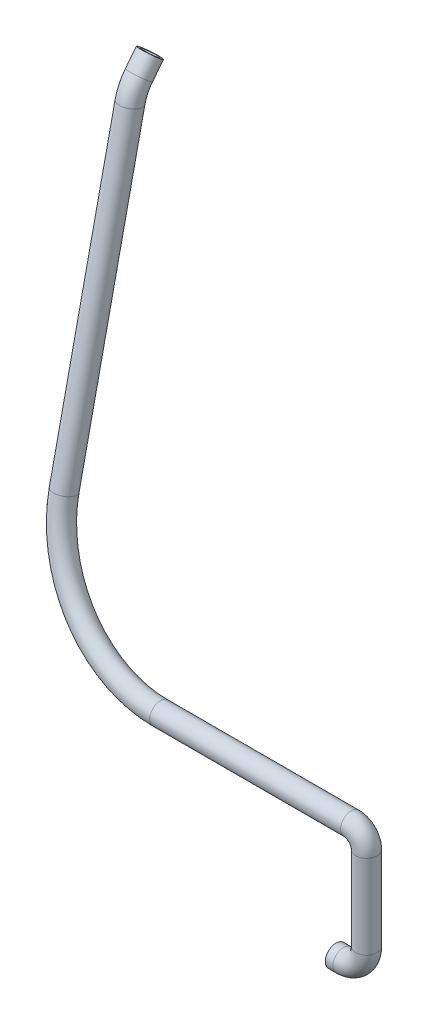
from build123d import *

# Parameters (mm, degrees)
SWEEP_THIN2_PROFILE_R   = 7
SWEEP_THIN2_PROFILE_R_2 = 5


with BuildPart() as part:
    # Sweep-Thin2: sweep along a curve in space
    with BuildLine() as sweep_thin2_path:
        Line((0, 0, 0), (5, 0, 0))
        ThreePointArc((20, 15, 0), (15.606601718, 4.393398282, 0), (5, 0, 0))
        Line((20, 15, 0), (20, 70, 0))
        ThreePointArc((20, 70, 0), (17.071067812, 77.071067812, 0), (10, 80, 0))
        Line((10, 80, 0), (-115, 80, 0))
        ThreePointArc((-115, 80, 0), (-171.568542495, 102.896965192, -4.976161754), (-195, 158.175129096, -16.989678949))
        Line((-195, 158.175129096, -16.989678949), (-195, 356.54458362, -60.101003285))
        ThreePointArc((-195, 356.54458362, -60.101003285), (-195, 363.03925528, -62.315548347), (-195, 368.860831535, -65.947933198))
        Line((-195, 368.860831535, -65.947933198), (-195, 377.945936742, -73.182099392))
    # Sweep-Thin2 profile (on start of the path) → Sweep-Thin2 (sweep)
    with BuildSketch(Plane(origin=(0, 0, 0), x_dir=(0, 0, 1), z_dir=(1, 0, 0))):
        Circle(SWEEP_THIN2_PROFILE_R)
        Circle(SWEEP_THIN2_PROFILE_R_2, mode=Mode.SUBTRACT)
    sweep(path=sweep_thin2_path.line)


solid = part.part
